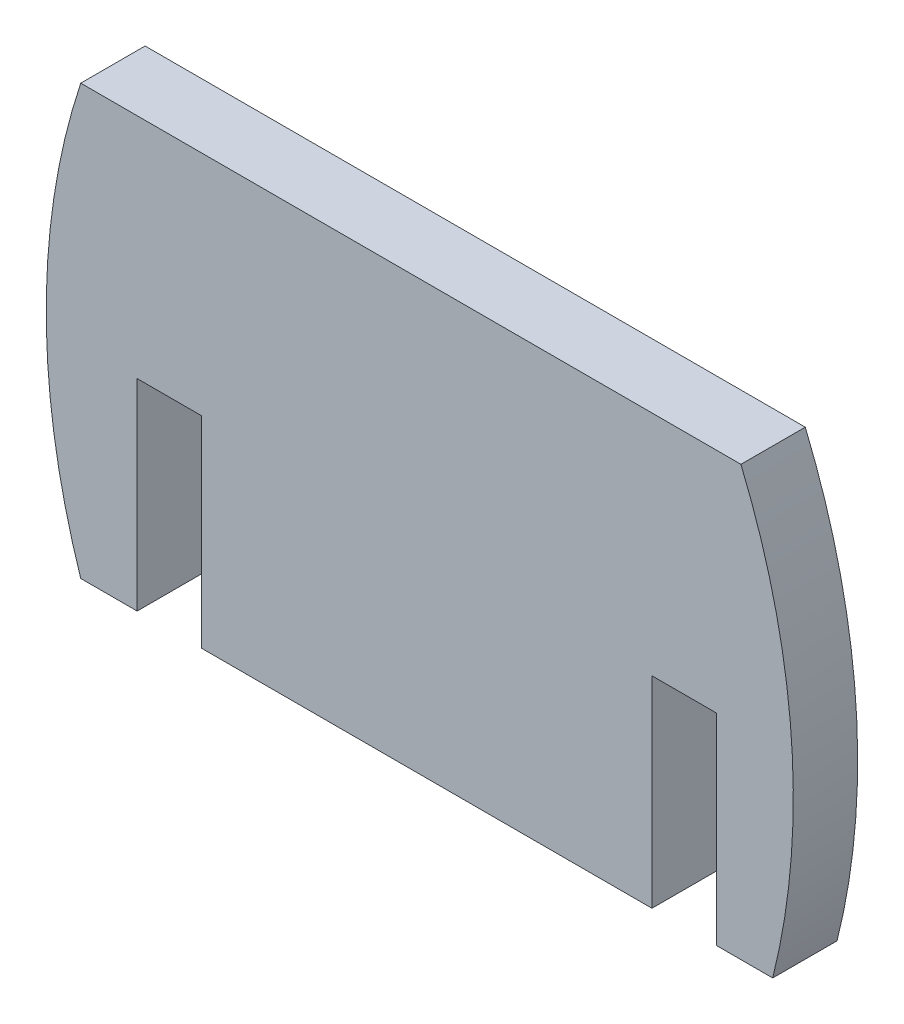
from build123d import *

# Parameters (mm, degrees)
BASE_EXTRUDE_DEPTH = 3


with BuildPart() as part:
    # Sketch1 → Base-Extrude (new body)
    with BuildSketch(Plane.XY):
        with BuildLine():
            Line((905.965375708, -110.41468189), (908.594990659, -110.41468189))
            ThreePointArc((908.594990659, -110.41468189), (909.468405337, -100.295175968), (907.11402855, -90.41468189))
            Line((907.11402855, -90.41468189), (876.335760757, -90.41468189))
            ThreePointArc((876.335760757, -90.41468189), (874.726506158, -100.41468189), (876.335760757, -110.41468189))
            Line((876.335760757, -110.41468189), (878.965375708, -110.41468189))
            Line((878.965375708, -110.41468189), (878.965375708, -101.027413417))
            Line((878.965375708, -101.027413417), (881.965375708, -101.027413417))
            Line((881.965375708, -101.027413417), (881.965375708, -110.41468189))
            Line((881.965375708, -110.41468189), (892.465375708, -110.41468189))
            Line((892.465375708, -110.41468189), (902.965375708, -110.41468189))
            Line((902.965375708, -110.41468189), (902.965375708, -101.027413417))
            Line((902.965375708, -101.027413417), (905.965375708, -101.027413417))
            Line((905.965375708, -101.027413417), (905.965375708, -110.41468189))
        make_face()
    extrude(amount=BASE_EXTRUDE_DEPTH)


solid = part.part
